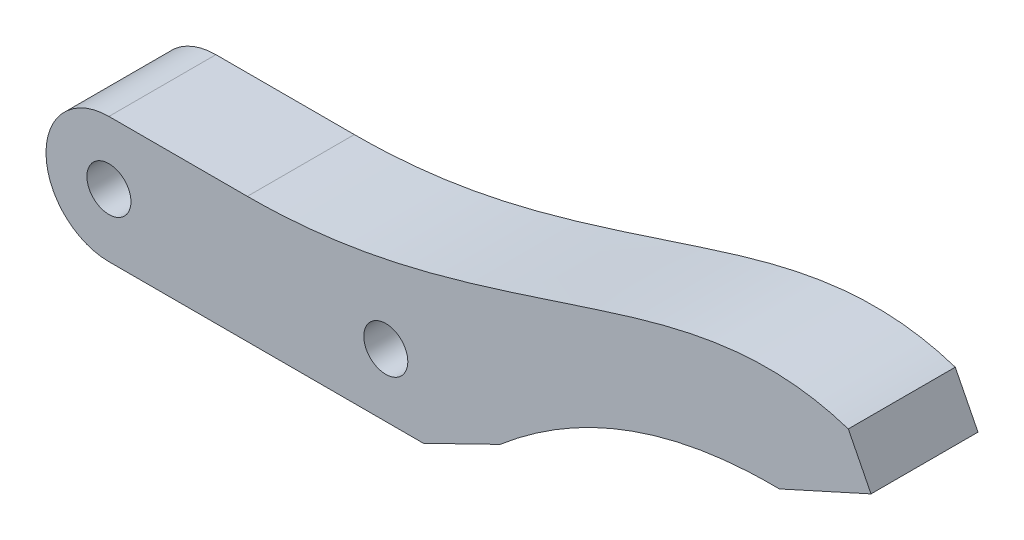
from build123d import *

# Parameters (mm, degrees)
SKETCH1_R           = 5
SKETCH1_R_2         = 1.75
BOSS_EXTRUDE1_DEPTH = 8.5
BOSS_EXTRUDE2_START = -8.5
BOSS_EXTRUDE2_DEPTH = 8.5


with BuildPart() as part:
    # Sketch1 → Boss-Extrude1 (new body)
    # profile 1 of 3: a face of its own
    with BuildSketch(Plane.XY):
        with Locations((-11, 0)):
            Circle(SKETCH1_R)
        with Locations((-11, 0)):
            Circle(SKETCH1_R_2, mode=Mode.SUBTRACT)
    # profile 2 of 3: a face of its own
    with BuildSketch(Plane.XY):
        with BuildLine():
            Line((11, 5), (-11, 5))
            ThreePointArc((-11, 5), (-7.464466094, 3.535533906), (-6, 0))
            ThreePointArc((-6, 0), (-7.464466094, -3.535533906), (-11, -5))
            Line((-11, -5), (11, -5))
            ThreePointArc((11, -5), (6, 0), (11, 5))
        make_face()
    # profile 3 of 3: a face of its own
    with BuildSketch(Plane.XY):
        with Locations((11, 0)):
            Circle(SKETCH1_R)
        with Locations((11, 0)):
            Circle(SKETCH1_R_2, mode=Mode.SUBTRACT)
    extrude(amount=BOSS_EXTRUDE1_DEPTH)

    # Sketch2 → Boss-Extrude2 (add)
    with BuildSketch(Plane.XY.offset(8.5).offset(BOSS_EXTRUDE2_START)):
        with BuildLine():
            Line((0, 5), (11, 5))
            ThreePointArc((11, 5), (16, 0), (11, -5))
            Line((11, -5), (13.99, -5))
            Line((13.99, -5), (20.08, -2.029708536))
            add(Edge.make_bspline(
                [(20.08, -2.029708536), (29.738723452, 6.188270814), (42.27, 6)],
                knots=[0, 0, 0, 1, 1, 1], degree=2))
            Line((42.27, 6), (49.557013712, 9.301428655))
            Line((49.557013712, 9.301428655), (47.75, 12.87))
            add(Edge.make_bspline(
                [(0, 5), (8.211836031, 5.003252827), (16.545155604, 7.403359581), (31.829335326, 12.436602795), (40.713583566, 15.205464732), (47.75, 12.87)],
                knots=[0, 0, 0, 0, 0.466100506, 0.566100506, 1, 1, 1, 1], degree=3))
        make_face()
    extrude(amount=BOSS_EXTRUDE2_DEPTH)


solid = part.part
